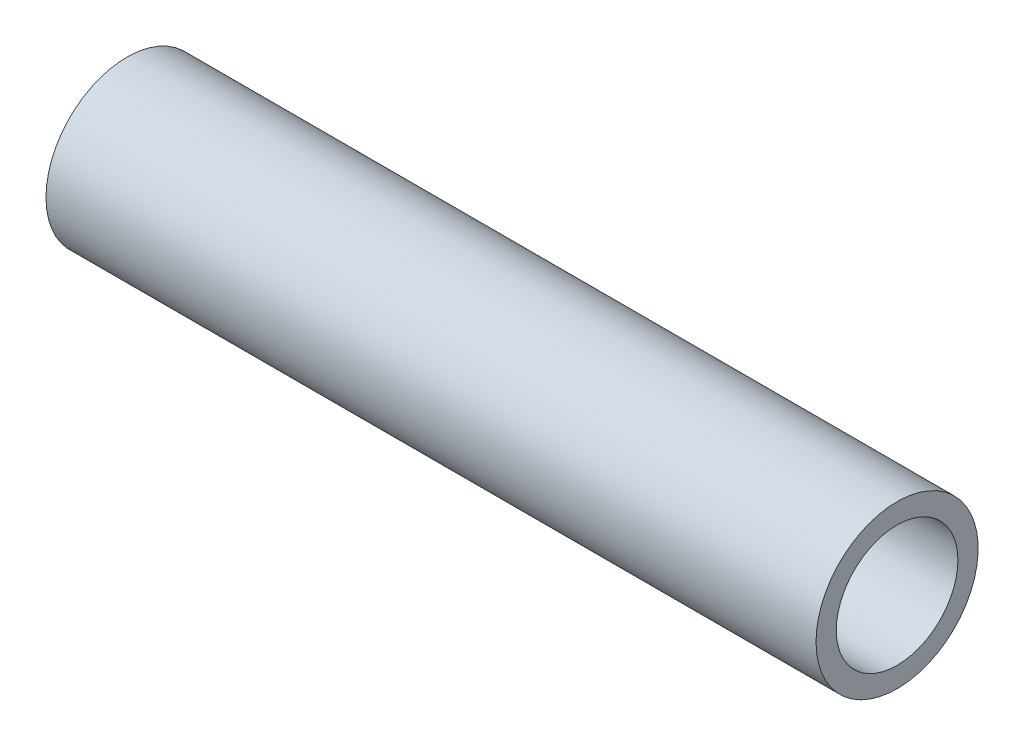
from build123d import *

# Parameters (mm, degrees)
SKETCH1_W = 38
SKETCH1_H = 4


with BuildPart() as part:
    # Sketch1 → Revolve1 (revolve)
    with BuildSketch(Plane.XY, mode=Mode.PRIVATE) as revolve1_sk:
        with Locations((19, 2)):
            Rectangle(SKETCH1_W, SKETCH1_H)
    revolve(revolve1_sk.sketch.rotate(Axis((0, 0, 0), (1, 0, 0)), 90), axis=Axis((0, 0, 0), (1, 0, 0)))

    # SurfaceCut1: cut with a surface, the side it looks to stays
    # Surface-Revolve1: a surface, the sketch's curves turned about an axis
    with BuildLine(Plane.XY, mode=Mode.PRIVATE) as surface_revolve1_1_path:
        Line((0, 3), (38, 3))
    surface_revolve1_1 = Shell.revolve(surface_revolve1_1_path.wire(), 360, Axis((0, 0, 0), (1, 0, 0)))
    split(bisect_by=surface_revolve1_1, keep=Keep.TOP)


solid = part.part
